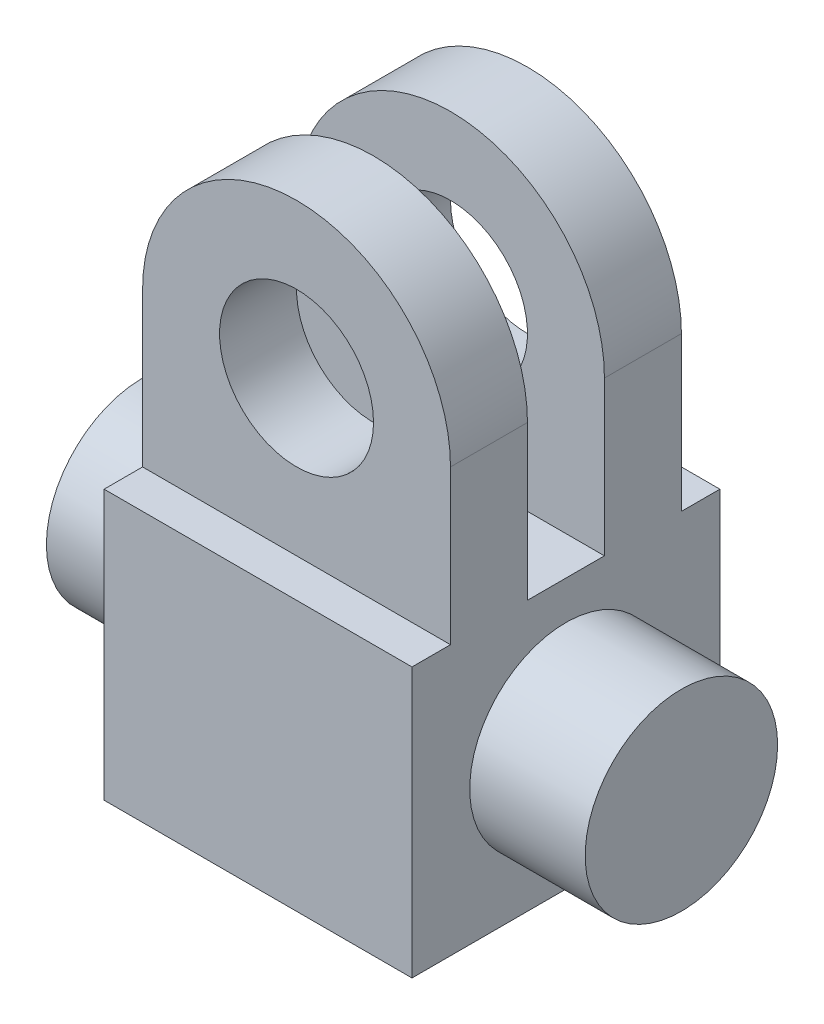
from build123d import *

# Parameters (mm, degrees)
SALIENTE_EXTRUIR1_DEPTH = 80
CROQUIS2_R              = 25
SALIENTE_EXTRUIR2_DEPTH = 30
SALIENTE_EXTRUIR3_START = 30
CROQUIS3_R              = 25
SALIENTE_EXTRUIR3_DEPTH = 30
CROQUIS4_R              = 20
SALIENTE_EXTRUIR5_DEPTH = 20
SALIENTE_EXTRUIR6_START = -20
CROQUIS5_R              = 20
SALIENTE_EXTRUIR6_DEPTH = 20


with BuildPart() as part:
    # Croquis1 → Saliente-Extruir1 (new body)
    with BuildSketch(Plane.XY):
        Polygon((0, 0), (40, 0), (40, 70), (-40, 70), (-40, 0), align=None)
    extrude(amount=-SALIENTE_EXTRUIR1_DEPTH)

    # Croquis2 → Saliente-Extruir2 (add)
    with BuildSketch(Plane(origin=(40, 0, 0), x_dir=(0, 0, -1), z_dir=(1, 0, 0))):
        with Locations((40, 35)):
            Circle(CROQUIS2_R)
    extrude(amount=SALIENTE_EXTRUIR2_DEPTH)

    # Croquis3 → Saliente-Extruir3 (add)
    with BuildSketch(Plane.ZY.offset(40).offset(SALIENTE_EXTRUIR3_START)):
        with Locations(Location((-40, 35, 0), (0, 0, 180))):
            Circle(CROQUIS3_R)
    extrude(amount=-SALIENTE_EXTRUIR3_DEPTH)

    # Croquis4 → Saliente-Extruir5 (add)
    with BuildSketch(Plane.XY.offset(-10)):
        with BuildLine():
            Line((-40, 110), (-40, 70))
            Line((-40, 70), (0, 70))
            Line((0, 70), (40, 70))
            Line((40, 70), (40, 110))
            ThreePointArc((40, 110), (0, 150), (-40, 110))
        make_face()
        with Locations((0, 110)):
            Circle(CROQUIS4_R, mode=Mode.SUBTRACT)
    extrude(amount=-SALIENTE_EXTRUIR5_DEPTH)

    # Croquis5 → Saliente-Extruir6 (add)
    with BuildSketch(Plane(origin=(0, 0, -70), x_dir=(-1, 0, 0), z_dir=(0, 0, -1)).offset(SALIENTE_EXTRUIR6_START)):
        with BuildLine():
            Line((-40, 110), (-40, 70))
            Line((-40, 70), (40, 70))
            Line((40, 70), (40, 110))
            ThreePointArc((40, 110), (0, 150), (-40, 110))
        make_face()
        with Locations(Location((0, 110, 0), (0, 0, 180))):
            Circle(CROQUIS5_R, mode=Mode.SUBTRACT)
    extrude(amount=SALIENTE_EXTRUIR6_DEPTH)


solid = part.part
